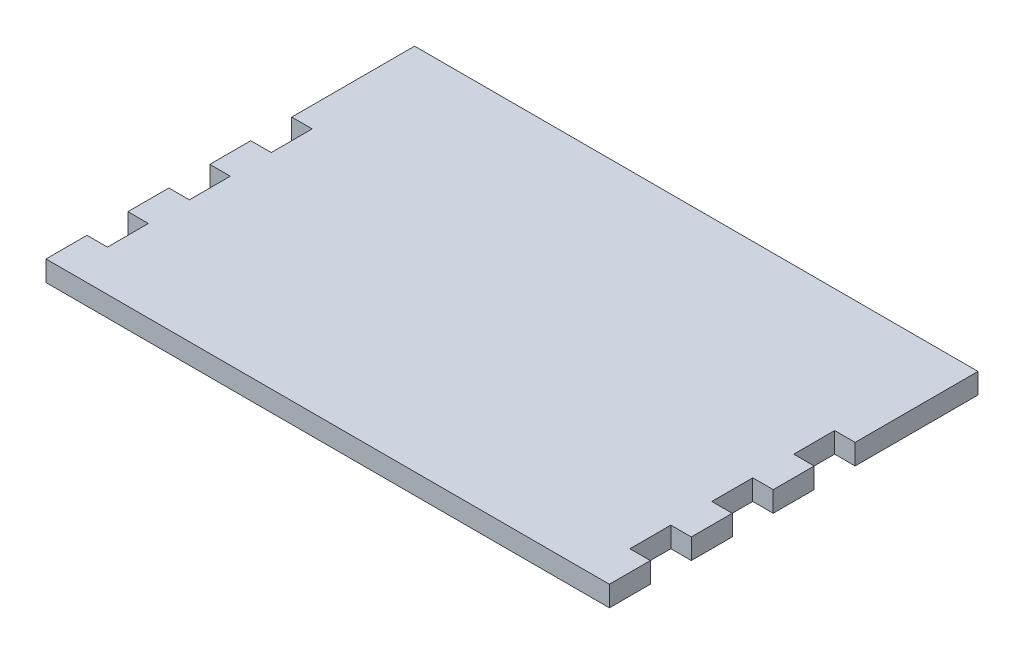
from build123d import *

# Parameters (mm, degrees)
BOSS_EXTRUDE1_DEPTH = 3.175


with BuildPart() as part:
    # Sketch1 → Boss-Extrude1 (new body)
    with BuildSketch(Plane(origin=(0, 0, 0), x_dir=(1, 0, 0), z_dir=(0, 1, 0))):
        Polygon((0, 0), (81, 0), (84.175, 0), (84.175, 6.35), (81, 6.35), (81, 12.7), (84.175, 12.7), (84.175, 19.05), (81, 19.05), (81, 25.4), (84.175, 25.4), (84.175, 31.75), (81, 31.75), (81, 38.1), (84.175, 38.1), (84.175, 44.45), (84.175, 57.15), (-3.175, 57.15), (-3.175, 44.45), (-3.175, 38.1), (0, 38.1), (0, 31.75), (-3.175, 31.75), (-3.175, 25.4), (0, 25.4), (0, 19.05), (-3.175, 19.05), (-3.175, 12.7), (0, 12.7), (0, 6.35), (-3.175, 6.35), (-3.175, 0), align=None)
    extrude(amount=BOSS_EXTRUDE1_DEPTH)


solid = part.part
